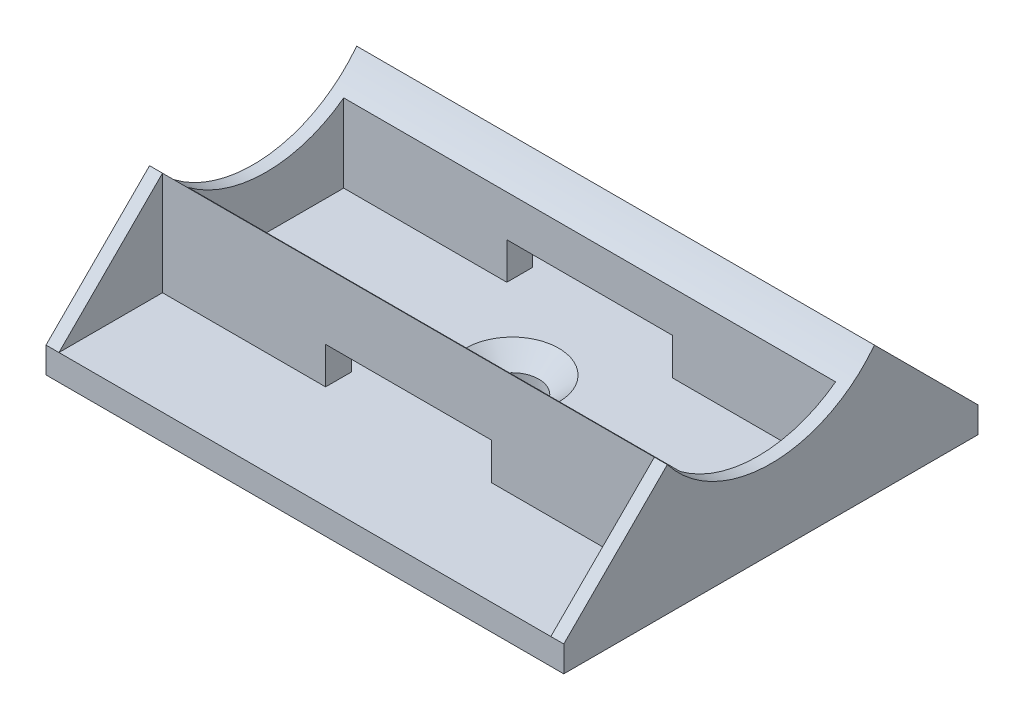
from build123d import *

# Parameters (mm, degrees)
SKETCH4_W           = 25.4
SKETCH4_H           = 1.5875
SKETCH4_W_2         = 1.5875
SKETCH4_H_2         = 6.35
BOSS_EXTRUDE2_DEPTH = 31.75
SKETCH5_W           = 9.525
SKETCH5_H           = 6.35
BOSS_EXTRUDE3_DEPTH = 0.79375
BOSS_EXTRUDE4_DEPTH = 0.79375
SKETCH7_W           = 10.16
SKETCH7_H           = 2.260476196
CUT_EXTRUDE1_DEPTH  = 38.867781903
CUT_EXTRUDE2_REACH  = 43.427
SKETCH8_R           = 8.011204241


with BuildPart() as part:
    # Sketch4 → Boss-Extrude2 (new body)
    with BuildSketch(Plane(origin=(0, 0, 0), x_dir=(0, 0, -1), z_dir=(1, 0, 0))):
        with Locations((12.7, 0.79375)):
            Rectangle(SKETCH4_W, SKETCH4_H)
        with Locations((7.14375, 4.7625)):
            Rectangle(SKETCH4_W_2, SKETCH4_H_2)
        with Locations((18.25625, 4.7625)):
            Rectangle(SKETCH4_W_2, SKETCH4_H_2)
    extrude(amount=BOSS_EXTRUDE2_DEPTH)

    # Sketch5 → Boss-Extrude3 (add)
    with BuildSketch(Plane(origin=(31.75, 0, 0), x_dir=(0, 0, -1), z_dir=(1, 0, 0))):
        Polygon((6.35, 7.9375), (0, 1.5875), (6.35, 1.5875), align=None)
        with Locations((12.7, 4.7625)):
            Rectangle(SKETCH5_W, SKETCH5_H)
        Polygon((19.05, 7.9375), (19.05, 1.5875), (25.4, 1.5875), align=None)
    extrude(amount=-BOSS_EXTRUDE3_DEPTH)

    # Sketch6 → Boss-Extrude4 (add)
    with BuildSketch(Plane.ZY):
        Polygon((-25.4, 1.5875), (0, 1.5875), (-6.35, 7.9375), (-19.05, 7.9375), align=None)
    extrude(amount=-BOSS_EXTRUDE4_DEPTH)

    # Sketch7 → Cut-Extrude1 (cut, through all)
    with BuildSketch(Plane.XY.offset(-6.35)):
        with Locations((15.875, 2.717738098)):
            Rectangle(SKETCH7_W, SKETCH7_H)
    extrude(amount=-CUT_EXTRUDE1_DEPTH, mode=Mode.SUBTRACT)

    # Sketch8 → Cut-Extrude2 (cut, up to next)
    with BuildSketch(Plane(origin=(31.75, 0, 0), x_dir=(0, 0, -1), z_dir=(1, 0, 0)), mode=Mode.PRIVATE) as cut_extrude2_sk1:
        with Locations((12.7, 12.82185189)):
            Circle(SKETCH8_R)
    cut_extrude2_tool1 = extrude(cut_extrude2_sk1.sketch, amount=-CUT_EXTRUDE2_REACH, mode=Mode.PRIVATE) & part.part
    add(cut_extrude2_tool1.solids().sort_by_distance((31.75, 12.821852, -12.7))[0], mode=Mode.SUBTRACT)

    # Sketch10 → CSK for #4 Flat Head Machine Screw (100)1 (revolve, cut)
    with BuildSketch(Plane(origin=(15.887282669, 1.5875, -12.697770178), x_dir=(0, 0, 1), z_dir=(1, 0, 0))):
        Polygon((0, 0), (0, 1.5875), (1.63195, 1.5875), (1.63195, 1.028358553), (2.8575, 0), align=None)
    revolve(axis=Axis((15.887282669, 7.9375, -12.697770178), (0, -1, 0)), mode=Mode.SUBTRACT)


solid = part.part
